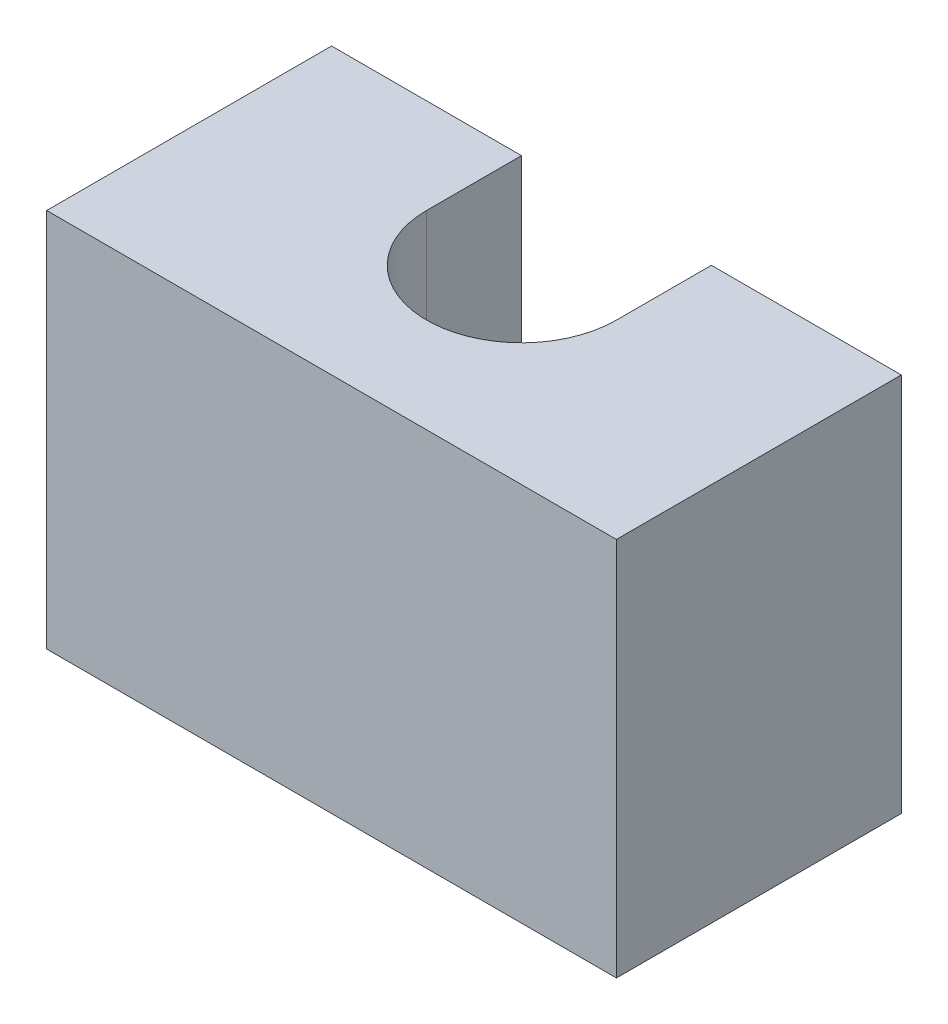
from build123d import *

# Parameters (mm, degrees)
BOSS_EXTRUDE1_DEPTH = 20


with BuildPart() as part:
    # Sketch2 → Boss-Extrude1 (new body)
    with BuildSketch(Plane(origin=(0, 0, 0), x_dir=(1, 0, 0), z_dir=(0, 1, 0))):
        with BuildLine():
            Line((-5, 0), (-5, -5))
            ThreePointArc((-5, -5), (0, -10), (5, -5))
            Line((5, -5), (5, 0))
            Line((5, 0), (15, 0))
            Line((15, 0), (15, -15))
            Line((15, -15), (-15, -15))
            Line((-15, -15), (-15, 0))
            Line((-15, 0), (-5, 0))
        make_face()
    extrude(amount=BOSS_EXTRUDE1_DEPTH)


solid = part.part
